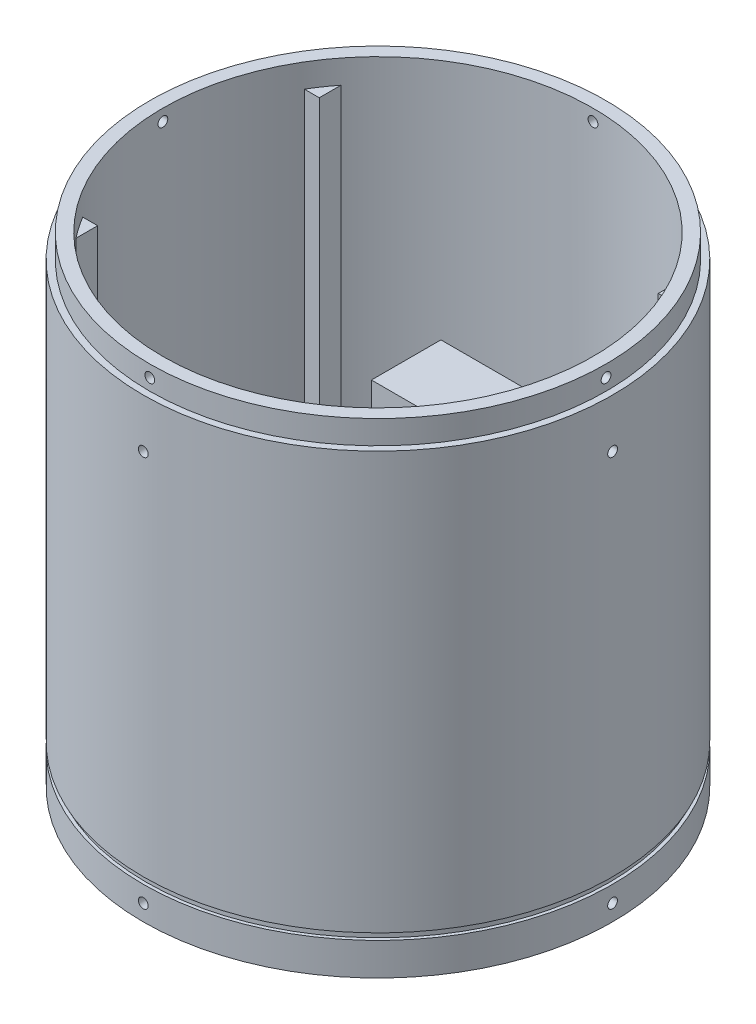
from build123d import *

# Parameters (mm, degrees)
SKETCH_6_R               = 72
SKETCH_6_R_2             = 70
EXTRUDE_1_DEPTH          = 140
SKETCH_6_15_R            = 70
SKETCH_6_15_R_2          = 66
EXTRUDE_2_DEPTH          = 147.25
SKETCH_6_16_R            = 66
EXTRUDE_3_DEPTH          = 3
EXTRUDE_6_DEPTH          = 140
F_2_5MM_3_REACH          = 216.42
F_2_5MM_3_BORE_R         = 1.5
PATTERN_CIRCULAR_1_COUNT = 4
SKETCH_33_W              = 1
SKETCH_33_H              = 2
PATTERN_CIRCULAR_2_COUNT = 4
SKETCH_40_W              = 72
SKETCH_40_H              = 21.317266744
EXTRUDE_8_DEPTH          = 70


with BuildPart() as part:
    # 草圖6 → 填料-伸長1 (new body)
    with BuildSketch(Plane(origin=(0, 0, 0), x_dir=(1, 0, 0), z_dir=(0, 1, 0))):
        with Locations(Location((0, 0, 0), (0, 0, 270))):
            Circle(SKETCH_6_R)
        with Locations(Location((0, 0, 0), (0, 0, 270))):
            Circle(SKETCH_6_R_2, mode=Mode.SUBTRACT)
    extrude(amount=EXTRUDE_1_DEPTH)

    # 草圖6<15> → 填料-伸長2 (add)
    with BuildSketch(Plane(origin=(0, 0, 0), x_dir=(1, 0, 0), z_dir=(0, 1, 0))):
        with Locations(Location((0, 0, 0), (0, 0, 270))):
            Circle(SKETCH_6_15_R)
        with Locations(Location((0, 0, 0), (0, 0, 270))):
            Circle(SKETCH_6_15_R_2, mode=Mode.SUBTRACT)
    extrude(amount=EXTRUDE_2_DEPTH)

    # 草圖6<16> → 填料-伸長3 (add)
    with BuildSketch(Plane(origin=(0, 0, 0), x_dir=(1, 0, 0), z_dir=(0, 1, 0))):
        with Locations(Location((0, 0, 0), (0, 0, 270))):
            Circle(SKETCH_6_16_R)
    extrude(amount=EXTRUDE_3_DEPTH)

    # 草圖9 → 填料-伸長6 (add)
    with BuildSketch(Plane(origin=(0, 0, 0), x_dir=(1, 0, 0), z_dir=(0, 1, 0))):
        with BuildLine():
            Line((-52, 34), (-52, 40.644802866))
            ThreePointArc((-52, 40.644802866), (-54.38584794, 37.392239086), (-56.568542495, 34))
            Line((-56.568542495, 34), (-52, 34))
        make_face()
        with BuildLine():
            Line((-52, -34), (-56.568542495, -34))
            ThreePointArc((-56.568542495, -34), (-54.38584794, -37.392239086), (-52, -40.644802866))
            Line((-52, -40.644802866), (-52, -34))
        make_face()
        with BuildLine():
            Line((56.568542495, -34), (52, -34))
            Line((52, -34), (52, -40.644802866))
            ThreePointArc((52, -40.644802866), (54.38584794, -37.392239086), (56.568542495, -34))
        make_face()
        with BuildLine():
            ThreePointArc((56.568542495, 34), (54.38584794, 37.392239086), (52, 40.644802866))
            Line((52, 40.644802866), (52, 34))
            Line((52, 34), (56.568542495, 34))
        make_face()
    extrude(amount=EXTRUDE_6_DEPTH)

    # Ø2.5mm 定位孔3 bore (on position points) → Ø2.5mm 定位孔3 (cut, up to next)
    with BuildSketch(Plane(origin=(70, 143.625, 0), x_dir=(0, 0, 1), z_dir=(1, 0, 0)), mode=Mode.PRIVATE) as f_2_5mm_3_sk1:
        Circle(F_2_5MM_3_BORE_R)
    f_2_5mm_3_tool1 = extrude(f_2_5mm_3_sk1.sketch, amount=-F_2_5MM_3_REACH, mode=Mode.PRIVATE) & part.part
    f_2_5mm_3 = f_2_5mm_3_tool1.solids().sort_by_distance((70, 143.625, 0))[0]
    add(f_2_5mm_3, mode=Mode.SUBTRACT)

    # 環狀複製排列1: Ø2.5mm 定位孔3 ×4 about axis
    pattern_circular_1_axis = Axis((0, 147.25, 0), (0, 1, 0))
    for i in range(1, PATTERN_CIRCULAR_1_COUNT):
        add(f_2_5mm_3.rotate(pattern_circular_1_axis, i * 360 / PATTERN_CIRCULAR_1_COUNT), mode=Mode.SUBTRACT)

    # 草圖33 → 除料-旋轉1 (revolve, cut)
    with BuildSketch(Plane.XY, mode=Mode.PRIVATE) as cut_revolve_1_sk:
        with Locations((-71.5, 11)):
            Rectangle(SKETCH_33_W, SKETCH_33_H)
    revolve(cut_revolve_1_sk.sketch.rotate(Axis((0, 147.25, 0), (0, -1, 0)), 270), axis=Axis((0, 147.25, 0), (0, -1, 0)), mode=Mode.SUBTRACT)

    # 草圖37 → Ø3.0mm 定位孔1 (revolve, cut)
    with BuildSketch(Plane(origin=(-72, 5, 0), x_dir=(0, 0, 1), z_dir=(0, 1, 0))):
        Polygon((0, 0), (0, 4.901290929), (1.5, 4), (1.5, 0), align=None)
    f_3_0mm_1 = revolve(axis=Axis((-78.35, 5, 0), (1, 0, 0)), mode=Mode.SUBTRACT)

    # 環狀複製排列2: Ø3.0mm 定位孔1 ×4 about axis
    pattern_circular_2_axis = Axis((0, 147.25, 0), (0, -1, 0))
    for i in range(1, PATTERN_CIRCULAR_2_COUNT):
        add(f_3_0mm_1.rotate(pattern_circular_2_axis, i * 360 / PATTERN_CIRCULAR_2_COUNT), mode=Mode.SUBTRACT)

    # 直線複製排列2 copy 1 sketch → 直線複製排列2 copy 1 (revolve, cut)
    with BuildSketch(Plane(origin=(0, 125, -72), x_dir=(-1, 0, 0), z_dir=(0, 1, 0))):
        Polygon((0, 0), (0, 4.901290929), (1.5, 4), (1.5, 0), align=None)
    revolve(axis=Axis((0, 125, -78.35), (0, 0, 1)), mode=Mode.SUBTRACT)

    # 直線複製排列2 copy 2 sketch → 直線複製排列2 copy 2 (revolve, cut)
    with BuildSketch(Plane(origin=(72, 125, 0), x_dir=(0, 0, -1), z_dir=(0, 1, 0))):
        Polygon((0, 0), (0, 4.901290929), (1.5, 4), (1.5, 0), align=None)
    revolve(axis=Axis((78.35, 125, 0), (-1, 0, 0)), mode=Mode.SUBTRACT)

    # 直線複製排列2 copy 3 sketch → 直線複製排列2 copy 3 (revolve, cut)
    with BuildSketch(Plane(origin=(0, 125, 72), x_dir=(1, 0, 0), z_dir=(0, 1, 0))):
        Polygon((0, 0), (0, 4.901290929), (1.5, 4), (1.5, 0), align=None)
    revolve(axis=Axis((0, 125, 78.35), (0, 0, -1)), mode=Mode.SUBTRACT)

    # 直線複製排列2 copy 4 sketch → 直線複製排列2 copy 4 (revolve, cut)
    with BuildSketch(Plane(origin=(-72, 125, 0), x_dir=(0, 0, 1), z_dir=(0, 1, 0))):
        Polygon((0, 0), (0, 4.901290929), (1.5, 4), (1.5, 0), align=None)
    revolve(axis=Axis((-78.35, 125, 0), (1, 0, 0)), mode=Mode.SUBTRACT)


with BuildPart() as body_2:
    # 草圖40 → 填料-伸長8 (new body)
    with BuildSketch(Plane(origin=(0, 3, 0), x_dir=(1, 0, 0), z_dir=(0, 1, 0))):
        with Locations((0, 44.658633372)):
            Rectangle(SKETCH_40_W, SKETCH_40_H)
    extrude(amount=EXTRUDE_8_DEPTH)


solid = Compound([part.part, body_2.part])
